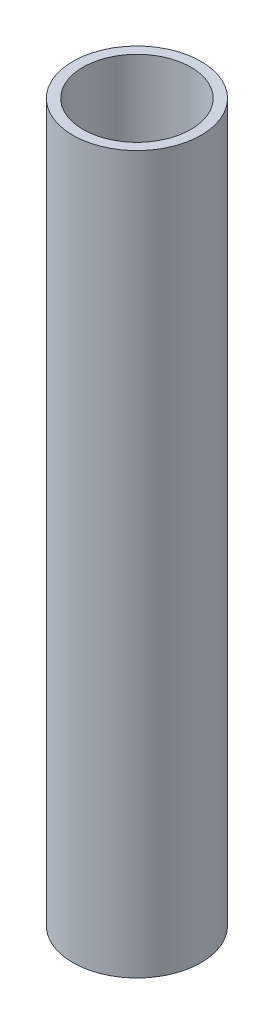
from build123d import *

# Parameters (mm, degrees)
SKETCH1_R           = 30.1625
SKETCH1_R_2         = 25.4
BOSS_EXTRUDE1_DEPTH = 168.656


with BuildPart() as part:
    # Sketch1 → Boss-Extrude1 (new, symmetric)
    with BuildSketch(Plane(origin=(0, 0, 0), x_dir=(1, 0, 0), z_dir=(0, 1, 0))):
        with Locations(Location((0, 0, 0), (0, 0, 270))):
            Circle(SKETCH1_R)
        with Locations(Location((0, 0, 0), (0, 0, 270))):
            Circle(SKETCH1_R_2, mode=Mode.SUBTRACT)
    extrude(amount=BOSS_EXTRUDE1_DEPTH, both=True)


solid = part.part
